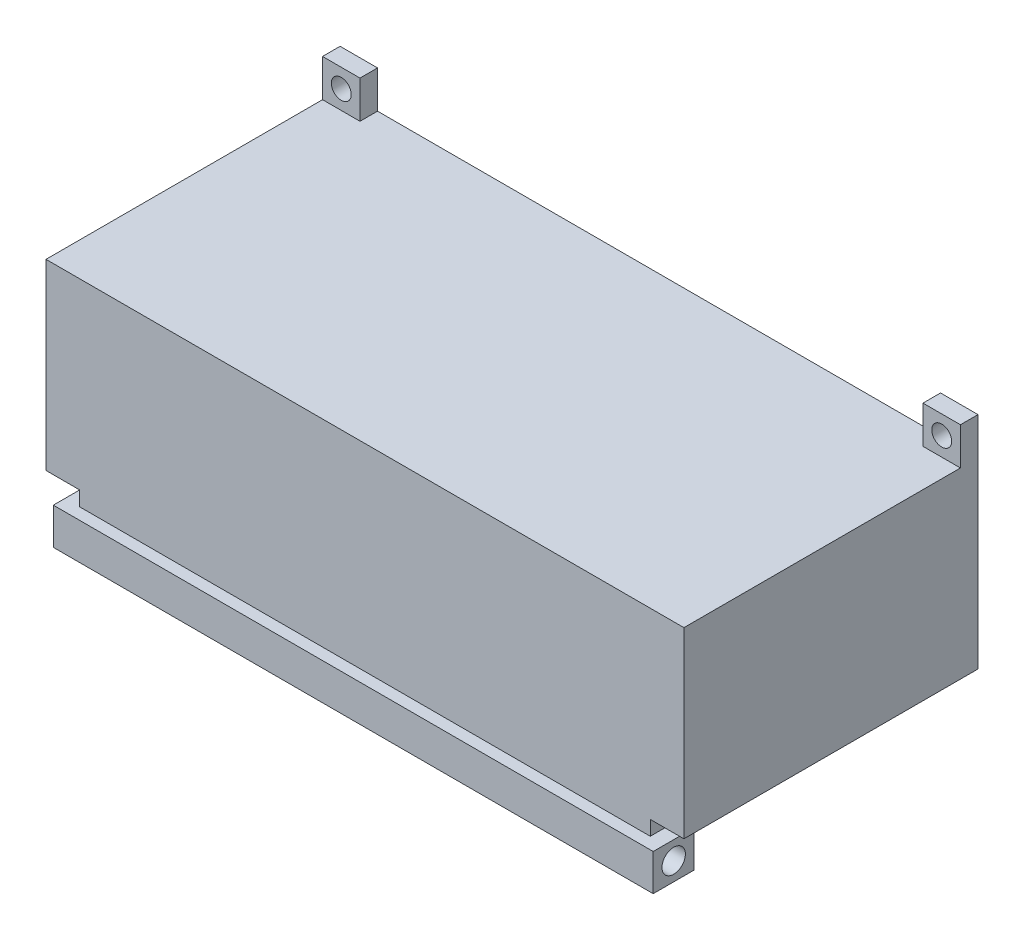
from build123d import *

# Parameters (mm, degrees)
BOSS_EXTRUDE2_DEPTH = 50.25
CUT_EXTRUDE3_DEPTH  = 37
SKETCH6_W           = 6.4
SKETCH6_H           = 6.4
SKETCH6_R           = 1.7
BOSS_EXTRUDE3_DEPTH = 3
SKETCH8_W           = 102.5
SKETCH8_H           = 6.25
BOSS_EXTRUDE4_DEPTH = 2
SKETCH7_R           = 2
CUT_EXTRUDE4_DEPTH  = 7


with BuildPart() as part:
    # Sketch4 → Boss-Extrude2 (new body)
    with BuildSketch(Plane.XY):
        Polygon((3.25, 0), (105.75, 0), (105.75, 6.25), (103.25, 6.25), (103.25, 8.75), (109, 8.75), (109, 40), (0, 40), (0, 8.75), (5.75, 8.75), (5.75, 6.25), (3.25, 6.25), align=None)
    extrude(amount=BOSS_EXTRUDE2_DEPTH)

    # Sketch5 → Cut-Extrude3 (cut)
    with BuildSketch(Plane.XZ):
        Polygon((3.25, 0), (8.418575633, 0), (100.815935432, 0), (105.75, 0), (105.75, 45.25), (100.75, 45.25), (100.75, 47.25), (8.25, 47.25), (8.25, 45.25), (3.25, 45.25), align=None)
    extrude(amount=-CUT_EXTRUDE3_DEPTH, mode=Mode.SUBTRACT)

    # Sketch6 → Boss-Extrude3 (add)
    # profile 1 of 2: a face of its own
    with BuildSketch(Plane(origin=(0, 0, 0), x_dir=(-1, 0, 0), z_dir=(0, 0, -1))):
        with Locations((-105.8, 43.2)):
            Rectangle(SKETCH6_W, SKETCH6_H)
        with Locations((-105.8, 43.2)):
            Circle(SKETCH6_R, mode=Mode.SUBTRACT)
    # profile 2 of 2: a face of its own
    with BuildSketch(Plane(origin=(0, 0, 0), x_dir=(-1, 0, 0), z_dir=(0, 0, -1))):
        with Locations((-3.2, 43.2)):
            Rectangle(SKETCH6_W, SKETCH6_H)
        with Locations((-3.2, 43.2)):
            Circle(SKETCH6_R, mode=Mode.SUBTRACT)
    extrude(amount=-BOSS_EXTRUDE3_DEPTH)

    # Sketch8 → Boss-Extrude4 (add)
    with BuildSketch(Plane.XY.offset(50.25)):
        with Locations((54.5, 3.125)):
            Rectangle(SKETCH8_W, SKETCH8_H)
    extrude(amount=BOSS_EXTRUDE4_DEPTH)

    # Sketch7 → Cut-Extrude4 (cut)
    with BuildSketch(Plane(origin=(105.75, 0, 0), x_dir=(0, 0, -1), z_dir=(1, 0, 0))):
        with Locations((-48.75, 3.125)):
            Circle(SKETCH7_R)
    cut_extrude4 = extrude(amount=-CUT_EXTRUDE4_DEPTH, mode=Mode.SUBTRACT)

    # Mirror1: Cut-Extrude4 across plane
    add(cut_extrude4.mirror(Plane(origin=(54.5, 0, 0), x_dir=(0, 0, 1), z_dir=(1, 0, 0))), mode=Mode.SUBTRACT)


solid = part.part
